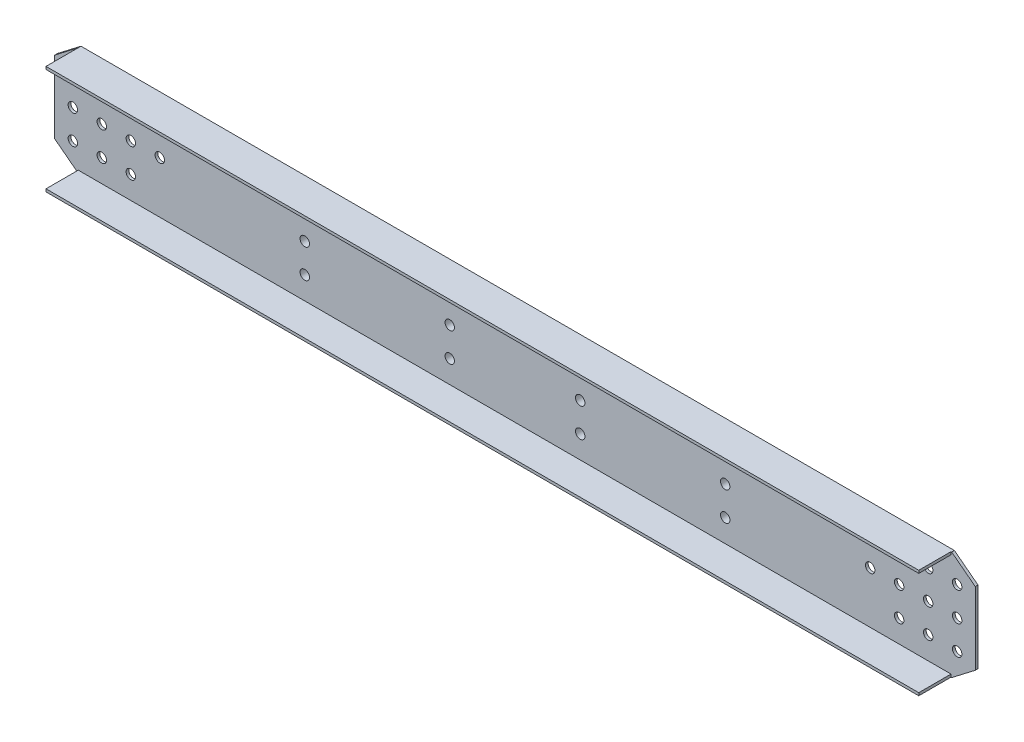
from build123d import *

# Parameters (mm, degrees)
SKETCH_1_R          = 13
EXTRUDE_634_DEPTH   = 7.5
SKETCH_2_W          = 2408.049034164
SKETCH_2_H          = 7.5
EXTRUDE_1_DEPTH     = 89
SKETCH_3_W          = 80
SKETCH_3_H          = 240
EXTRUDE_2_DEPTH     = 16
SKETCH_4_R          = 13
CUT_EXTRUDE_1_DEPTH = 1308.983562588


with BuildPart() as part:
    # 草图1 → Extrude 634 (new body)
    with BuildSketch(Plane.XY):
        Polygon((-1205, 0), (1205, 0), (1270, 50), (1270, 250), (1205, 300), (-1205, 300), (-1270, 250), (-1270, 50), align=None)
        with Locations((-1220, 230)):
            Circle(SKETCH_1_R, mode=Mode.SUBTRACT)
        with Locations((-1220, 150)):
            Circle(SKETCH_1_R, mode=Mode.SUBTRACT)
        with Locations((-1140, 230)):
            Circle(SKETCH_1_R, mode=Mode.SUBTRACT)
        with Locations((-1140, 150)):
            Circle(SKETCH_1_R, mode=Mode.SUBTRACT)
        with Locations((-1060, 230)):
            Circle(SKETCH_1_R, mode=Mode.SUBTRACT)
        with Locations((-1060, 150)):
            Circle(SKETCH_1_R, mode=Mode.SUBTRACT)
        with Locations((-980, 150)):
            Circle(SKETCH_1_R, mode=Mode.SUBTRACT)
        with Locations(Location((-1060, 70, 0), (0, 0, 180))):
            Circle(SKETCH_1_R, mode=Mode.SUBTRACT)
        with Locations(Location((-1140, 70, 0), (0, 0, 180))):
            Circle(SKETCH_1_R, mode=Mode.SUBTRACT)
        with Locations(Location((-1220, 70, 0), (0, 0, 180))):
            Circle(SKETCH_1_R, mode=Mode.SUBTRACT)
        with Locations((1220, 70)):
            Circle(SKETCH_1_R, mode=Mode.SUBTRACT)
        with Locations((1140, 70)):
            Circle(SKETCH_1_R, mode=Mode.SUBTRACT)
        with Locations((1060, 70)):
            Circle(SKETCH_1_R, mode=Mode.SUBTRACT)
        with Locations(Location((980, 150, 0), (0, 0, 180))):
            Circle(SKETCH_1_R, mode=Mode.SUBTRACT)
        with Locations(Location((1060, 150, 0), (0, 0, 180))):
            Circle(SKETCH_1_R, mode=Mode.SUBTRACT)
        with Locations(Location((1060, 230, 0), (0, 0, 180))):
            Circle(SKETCH_1_R, mode=Mode.SUBTRACT)
        with Locations(Location((1140, 150, 0), (0, 0, 180))):
            Circle(SKETCH_1_R, mode=Mode.SUBTRACT)
        with Locations(Location((1140, 230, 0), (0, 0, 180))):
            Circle(SKETCH_1_R, mode=Mode.SUBTRACT)
        with Locations(Location((1220, 150, 0), (0, 0, 180))):
            Circle(SKETCH_1_R, mode=Mode.SUBTRACT)
        with Locations(Location((1220, 230, 0), (0, 0, 180))):
            Circle(SKETCH_1_R, mode=Mode.SUBTRACT)
    extrude(amount=-EXTRUDE_634_DEPTH)

    # 草图2 → 凸台-拉伸1 (add)
    with BuildSketch(Plane.XY):
        with Locations((-0.975482918, 296.25)):
            Rectangle(SKETCH_2_W, SKETCH_2_H)
        with Locations((-0.975482918, 3.75)):
            Rectangle(SKETCH_2_W, SKETCH_2_H)
    extrude(amount=EXTRUDE_1_DEPTH)

    # 草图3 → 凸台-拉伸2 (add)
    with BuildSketch(Plane(origin=(0, 0, -7.5), x_dir=(-1, 0, 0), z_dir=(0, 0, -1))):
        with Locations((-580, 150)):
            Rectangle(SKETCH_3_W, SKETCH_3_H)
        with Locations((-180, 150)):
            Rectangle(SKETCH_3_W, SKETCH_3_H)
        with Locations((180, 150)):
            Rectangle(SKETCH_3_W, SKETCH_3_H)
        with Locations((580, 150)):
            Rectangle(SKETCH_3_W, SKETCH_3_H)
    extrude(amount=EXTRUDE_2_DEPTH)

    # 草图4 → 切除-拉伸1 (cut, through all)
    with BuildSketch(Plane.XY):
        with Locations((-580, 230)):
            Circle(SKETCH_4_R)
        with Locations((-580, 150)):
            Circle(SKETCH_4_R)
        with Locations((-180, 230)):
            Circle(SKETCH_4_R)
        with Locations((-180, 150)):
            Circle(SKETCH_4_R)
        with Locations(Location((-180, 70, 0), (0, 0, 180))):
            Circle(SKETCH_4_R)
        with Locations(Location((-580, 70, 0), (0, 0, 180))):
            Circle(SKETCH_4_R)
        with Locations((580, 70)):
            Circle(SKETCH_4_R)
        with Locations((180, 70)):
            Circle(SKETCH_4_R)
        with Locations(Location((180, 150, 0), (0, 0, 180))):
            Circle(SKETCH_4_R)
        with Locations(Location((180, 230, 0), (0, 0, 180))):
            Circle(SKETCH_4_R)
        with Locations(Location((580, 150, 0), (0, 0, 180))):
            Circle(SKETCH_4_R)
        with Locations(Location((580, 230, 0), (0, 0, 180))):
            Circle(SKETCH_4_R)
    extrude(amount=-CUT_EXTRUDE_1_DEPTH, mode=Mode.SUBTRACT)


solid = part.part
